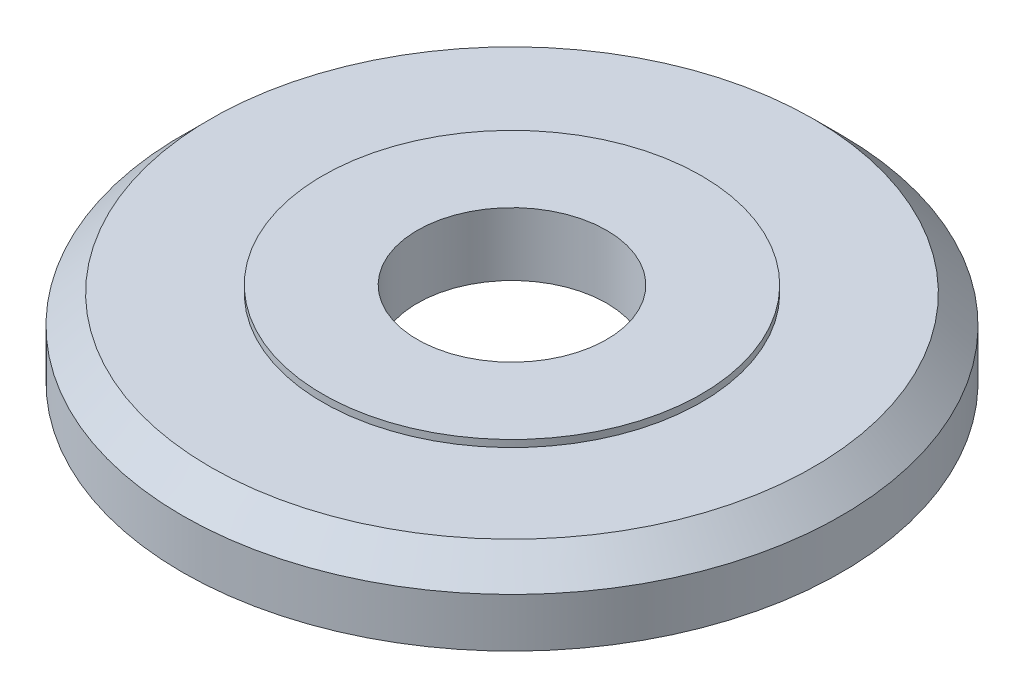
from build123d import *


with BuildPart() as part:
    # Эскиз1 → Повернуть1 (revolve)
    with BuildSketch(Plane.XY, mode=Mode.PRIVATE) as revolve_1_sk:
        Polygon((13.5, 0), (13.5, 9), (27, 9), (27, 8), (43, 8), (47, 4), (47, -3), (45, -3), (45, 1), (39, 1), (39, -2), (37, -2), (36, 0), align=None)
    revolve(revolve_1_sk.sketch.rotate(Axis((0, 3.397027972, 0), (0, 1, 0)), 90), axis=Axis((0, 3.397027972, 0), (0, 1, 0)))


solid = part.part
